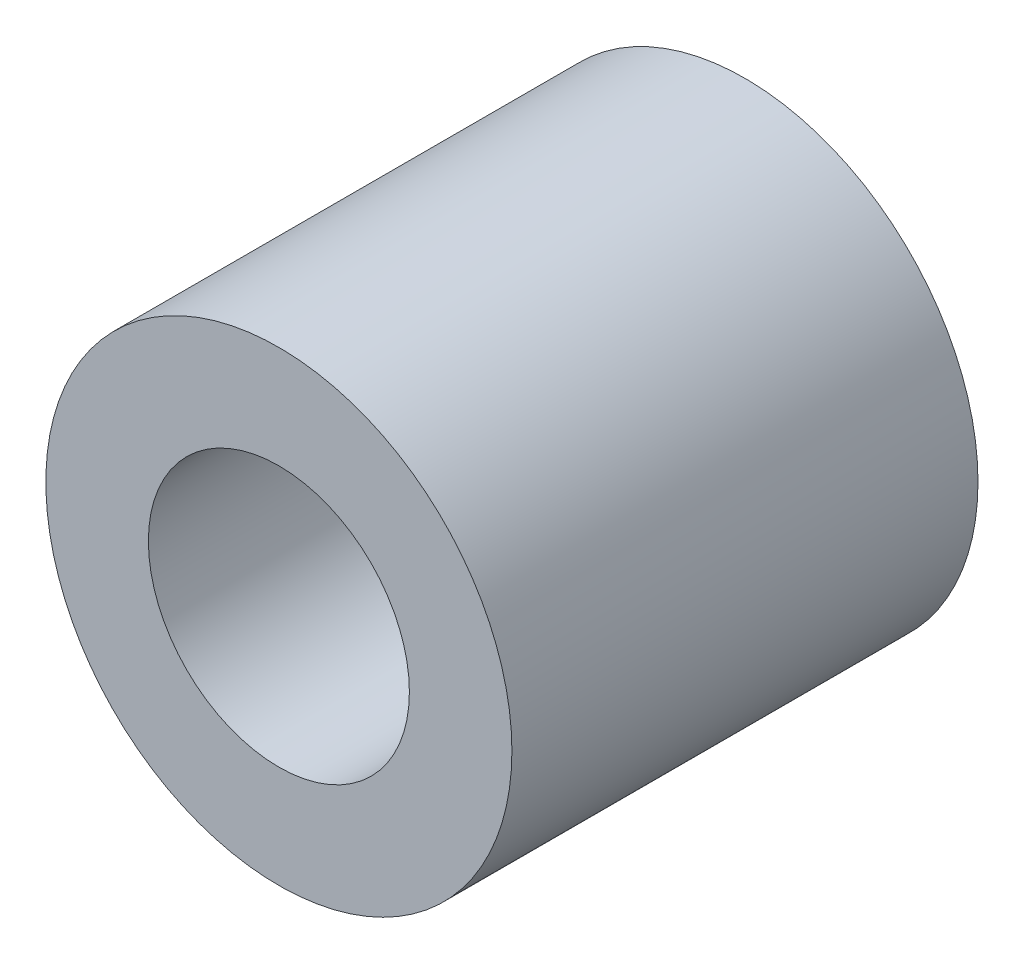
from build123d import *

# Parameters (mm, degrees)
SKETCH1_R      = 3.175
SKETCH1_R_2    = 1.778
EXTRUDE1_DEPTH = 3.175


with BuildPart() as part:
    # Sketch1 → Extrude1 (new, symmetric)
    with BuildSketch(Plane.XY):
        Circle(SKETCH1_R)
        Circle(SKETCH1_R_2, mode=Mode.SUBTRACT)
    extrude(amount=EXTRUDE1_DEPTH, both=True)


solid = part.part
